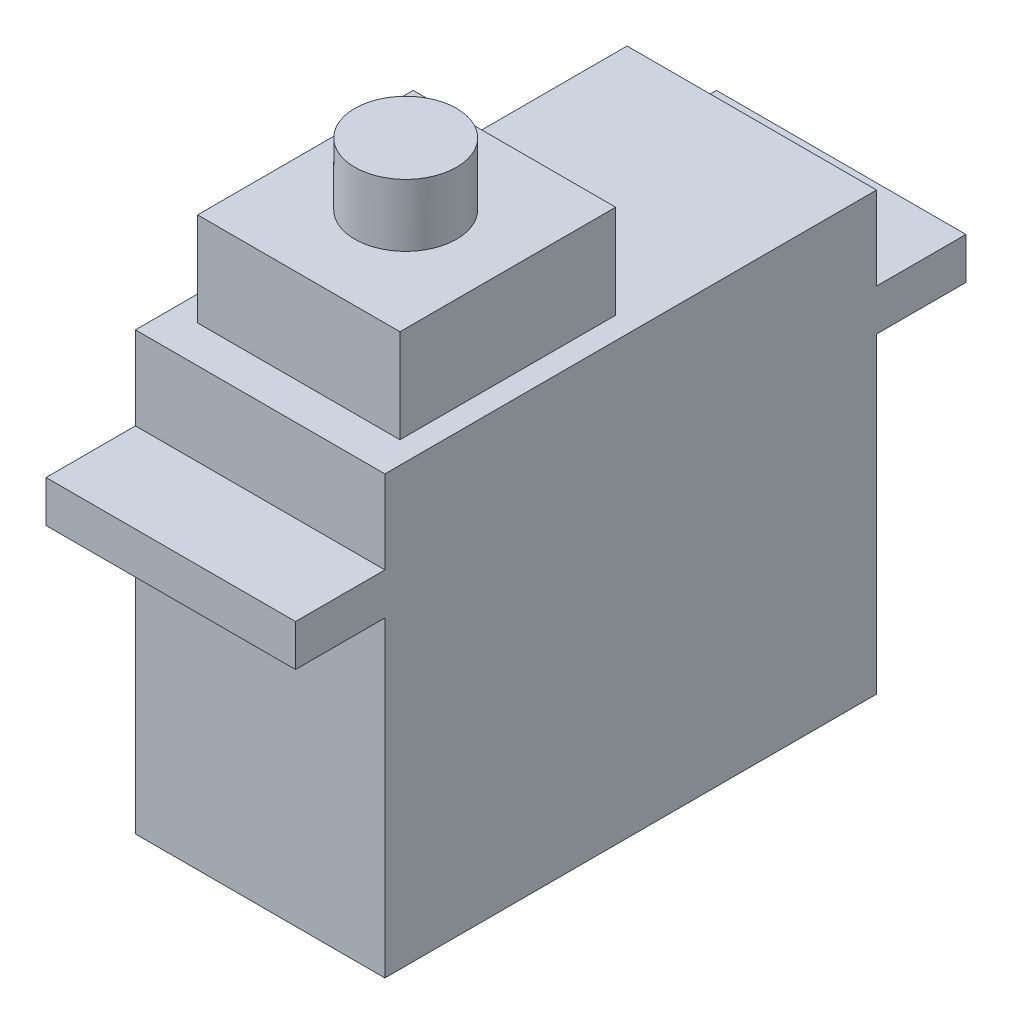
from build123d import *

# Parameters (mm, degrees)
BOSS_EXTRUDE1_DEPTH = 6
BOSS_EXTRUDE2_START = -4
SKETCH2_W           = 9.735530135
SKETCH2_H           = 10.374223994
BOSS_EXTRUDE2_DEPTH = 8.5
SKETCH3_R           = 2.45
BOSS_EXTRUDE3_DEPTH = 7.5


with BuildPart() as part:
    # Sketch1 → Boss-Extrude1 (new, symmetric)
    with BuildSketch(Plane(origin=(0, 0, 0), x_dir=(0, 0, -1), z_dir=(1, 0, 0))):
        Polygon((-11.825, 6.5), (-11.825, 10.5), (11.825, 10.5), (11.825, 6.5), (16.125, 6.5), (16.125, 4.5), (11.825, 4.5), (11.825, -10.5), (-11.825, -10.5), (-11.825, 4.5), (-16.125, 4.5), (-16.125, 6.5), align=None)
    extrude(amount=BOSS_EXTRUDE1_DEPTH, both=True)

    # Sketch2 → Boss-Extrude2 (add)
    with BuildSketch(Plane(origin=(0, 10.5, 0), x_dir=(1, 0, 0), z_dir=(0, 1, 0)).offset(BOSS_EXTRUDE2_START)):
        with Locations((0.07225674, -4.853907597)):
            Rectangle(SKETCH2_W, SKETCH2_H)
    extrude(amount=BOSS_EXTRUDE2_DEPTH)

    # Sketch3 → Boss-Extrude3 (add)
    with BuildSketch(Plane(origin=(0, 10.5, 0), x_dir=(1, 0, 0), z_dir=(0, 1, 0))):
        with Locations(Location((0, -4.825, 0), (0, 0, 90))):
            Circle(SKETCH3_R)
    extrude(amount=BOSS_EXTRUDE3_DEPTH)


solid = part.part
